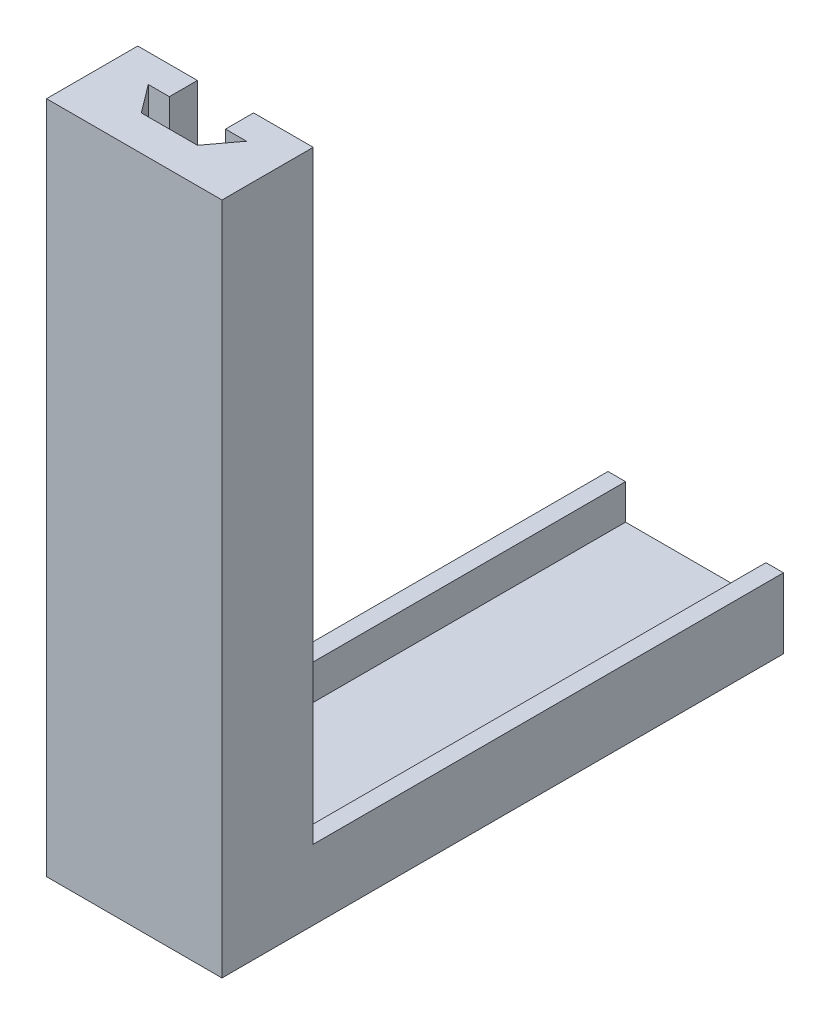
from build123d import *

# Parameters (mm, degrees)
SKETCH1_W           = 25
SKETCH1_H           = 80
BOSS_EXTRUDE1_DEPTH = 10
SKETCH2_W           = 25
SKETCH2_H           = 13
BOSS_EXTRUDE2_DEPTH = 86
CUT_EXTRUDE1_DEPTH  = 91
SKETCH4_W           = 20
SKETCH4_H           = 67
CUT_EXTRUDE2_DEPTH  = 5


with BuildPart() as part:
    # Sketch1 → Boss-Extrude1 (new body)
    with BuildSketch(Plane(origin=(0, 0, 0), x_dir=(1, 0, 0), z_dir=(0, 1, 0))):
        Rectangle(SKETCH1_W, SKETCH1_H)
    extrude(amount=BOSS_EXTRUDE1_DEPTH)

    # Sketch2 → Boss-Extrude2 (add)
    with BuildSketch(Plane(origin=(0, 10, 0), x_dir=(1, 0, 0), z_dir=(0, 1, 0))):
        with Locations((0, -33.5)):
            Rectangle(SKETCH2_W, SKETCH2_H)
    extrude(amount=BOSS_EXTRUDE2_DEPTH)

    # Sketch3 → Cut-Extrude1 (cut)
    with BuildSketch(Plane(origin=(0, 96, 0), x_dir=(1, 0, 0), z_dir=(0, 1, 0))):
        Polygon((-4, -27), (4, -27), (4, -31), (7, -31), (4, -35), (-4, -35), (-7, -31), (-4, -31), align=None)
    extrude(amount=-CUT_EXTRUDE1_DEPTH, mode=Mode.SUBTRACT)

    # Sketch4 → Cut-Extrude2 (cut)
    with BuildSketch(Plane(origin=(0, 10, 0), x_dir=(1, 0, 0), z_dir=(0, 1, 0))):
        with Locations((0, 6.5)):
            Rectangle(SKETCH4_W, SKETCH4_H)
    extrude(amount=-CUT_EXTRUDE2_DEPTH, mode=Mode.SUBTRACT)


solid = part.part
